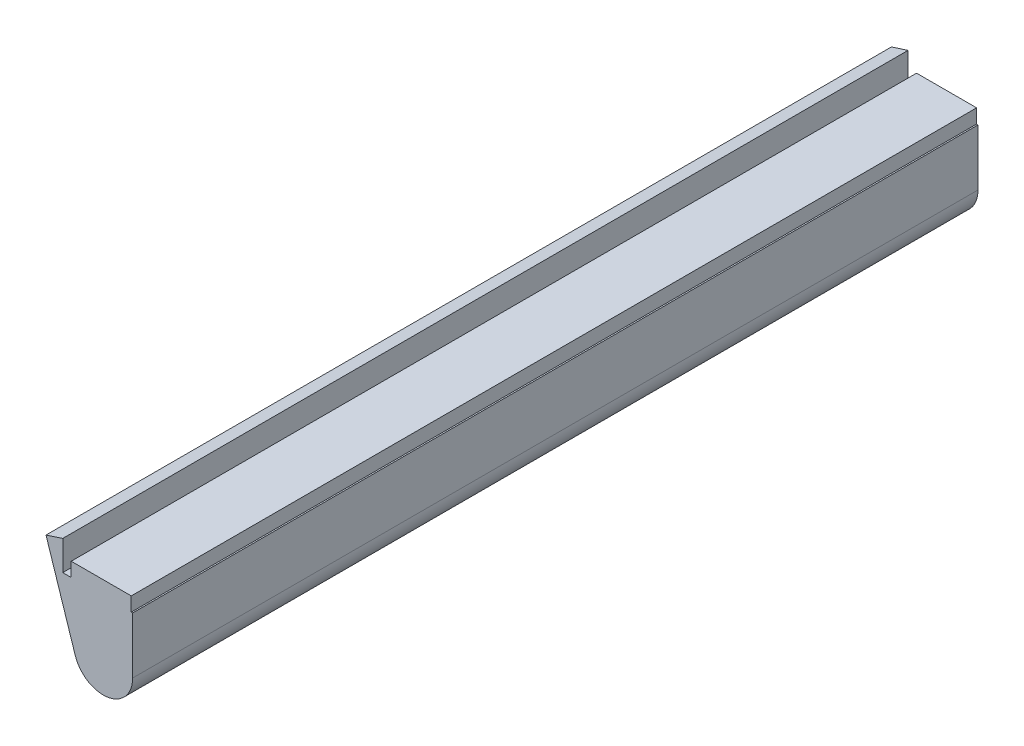
from build123d import *

# Parameters (mm, degrees)
BOSS_EXTRUDE1_DEPTH = 300


with BuildPart() as part:
    # Sketch1 → Boss-Extrude1 (new body)
    with BuildSketch(Plane.XY):
        with BuildLine():
            Line((0, -5), (0, -10))
            Line((0, -10), (-3, -10))
            Line((-3, -10), (-3, 0.518235133))
            Line((-3, 0.518235133), (-8.952395517, -1.422763405))
            Line((-8.952395517, -1.422763405), (1.422311977, -33.238533054))
            ThreePointArc((1.422311977, -33.238533054), (12.993401498, -40.316712963), (21.8, -30))
            Line((21.8, -30), (21.8, -10))
            Line((21.8, -10), (21.3, -10))
            Line((21.3, -10), (21.3, -5))
            Line((21.3, -5), (0, -5))
        make_face()
    extrude(amount=-BOSS_EXTRUDE1_DEPTH)


solid = part.part
